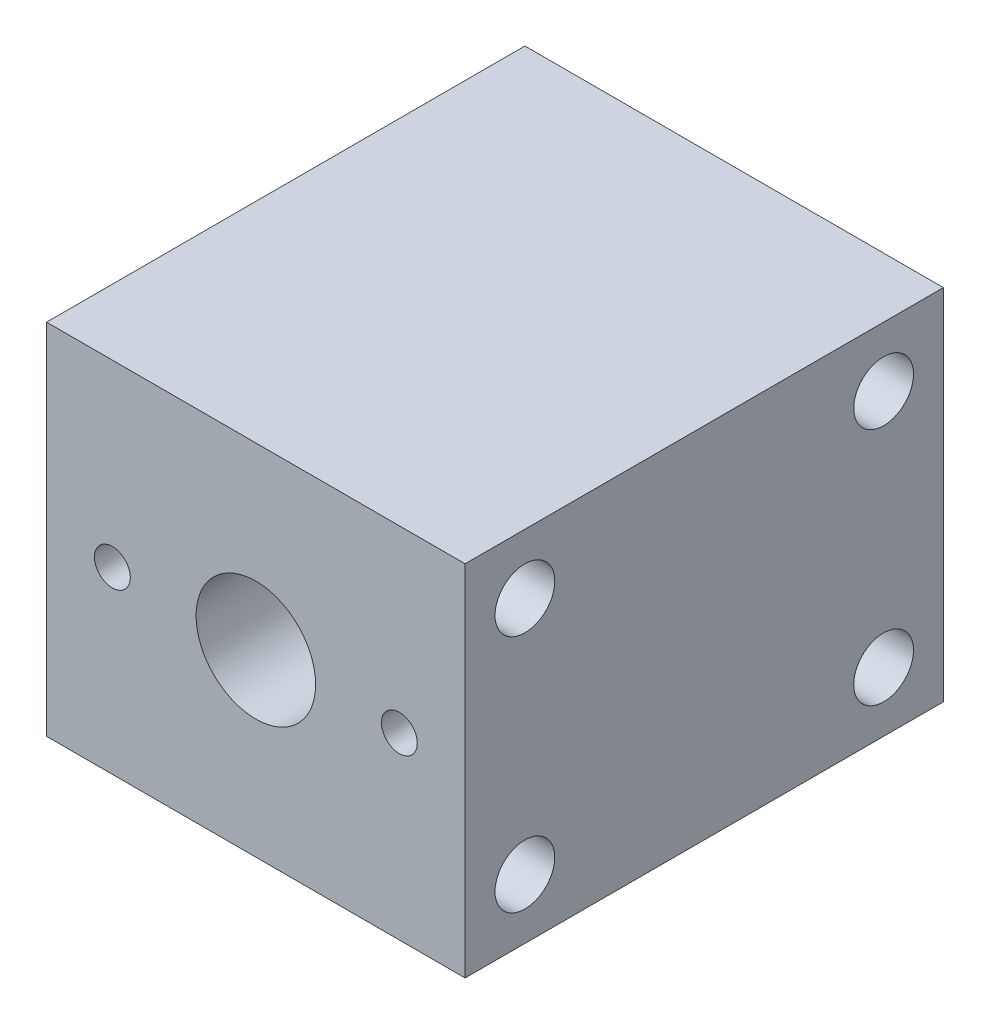
from build123d import *

# Parameters (mm, degrees)
SKETCH1_W           = 35
SKETCH1_H           = 30
SKETCH1_R           = 5
BOSS_EXTRUDE1_DEPTH = 20
SKETCH2_R           = 2.5
CUT_EXTRUDE1_DEPTH  = 44.011626335
SKETCH3_R           = 1.5
CUT_EXTRUDE2_DEPTH  = 47.165463282


with BuildPart() as part:
    # Sketch1 → Boss-Extrude1 (new, symmetric)
    with BuildSketch(Plane.XY):
        Rectangle(SKETCH1_W, SKETCH1_H)
        Circle(SKETCH1_R, mode=Mode.SUBTRACT)
    extrude(amount=BOSS_EXTRUDE1_DEPTH, both=True)

    # Sketch2 → Cut-Extrude1 (cut, through all)
    with BuildSketch(Plane(origin=(17.5, 0, 0), x_dir=(0, 0, -1), z_dir=(1, 0, 0))):
        with Locations((-15, 10)):
            Circle(SKETCH2_R)
        with Locations((15, 10)):
            Circle(SKETCH2_R)
        with Locations(Location((15, -10, 0), (0, 0, 180))):
            Circle(SKETCH2_R)
        with Locations(Location((-15, -10, 0), (0, 0, 180))):
            Circle(SKETCH2_R)
    extrude(amount=-CUT_EXTRUDE1_DEPTH, mode=Mode.SUBTRACT)

    # Sketch3 → Cut-Extrude2 (cut, through all)
    with BuildSketch(Plane.XY.offset(20)):
        with Locations((12, 0)):
            Circle(SKETCH3_R)
        with Locations((-12, 0)):
            Circle(SKETCH3_R)
    extrude(amount=-CUT_EXTRUDE2_DEPTH, mode=Mode.SUBTRACT)


solid = part.part
